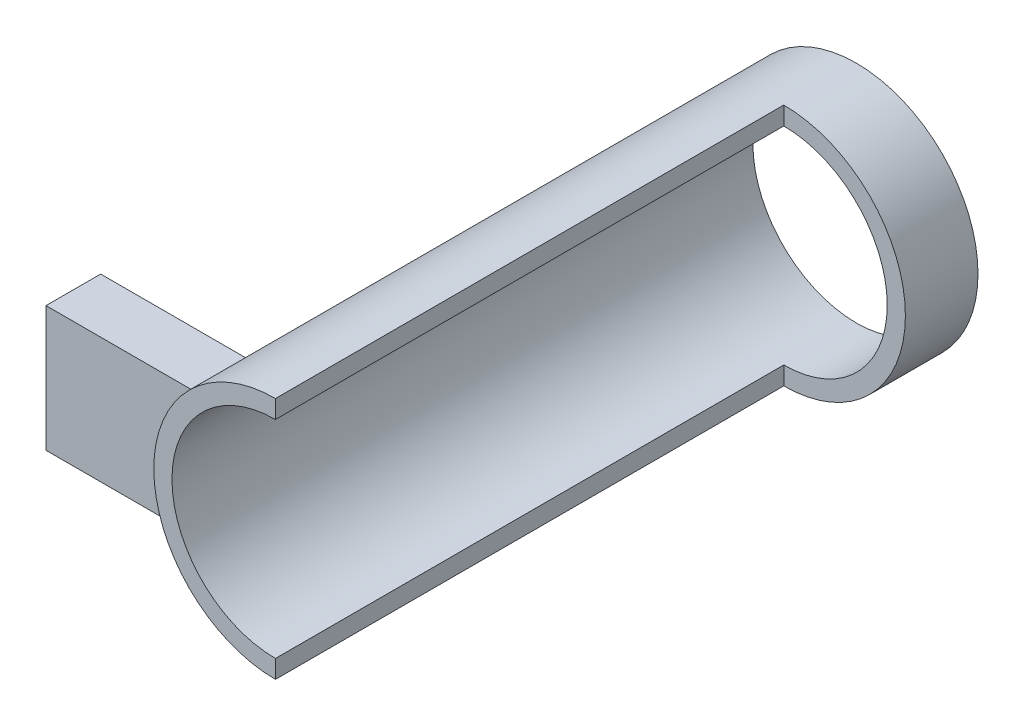
from build123d import *

# Parameters (mm, degrees)
ESQUISSE1_R             = 3.35
ESQUISSE1_R_2           = 2.85
BOSS_EXTRU_1_DEPTH      = 2
BOSS_EXTRU_2_DEPTH      = 14
ESQUISSE3_W             = 1.505412516
ESQUISSE3_H             = 3.452066632
BOSS_EXTRU_3_DEPTH      = 7
ENL_V_START             = -5
ESQUISSE4_R             = 2.85
ENL_V_MAT_EXTRU_1_DEPTH = 5


with BuildPart() as part:
    # Esquisse1 → Boss.-Extru.1 (new body)
    with BuildSketch(Plane.XY):
        Circle(ESQUISSE1_R)
        Circle(ESQUISSE1_R_2, mode=Mode.SUBTRACT)
    extrude(amount=BOSS_EXTRU_1_DEPTH)

    # Esquisse2 → Boss.-Extru.2 (add)
    with BuildSketch(Plane.XY.offset(2)):
        with BuildLine():
            Line((0, 3.35), (0, 2.85))
            ThreePointArc((0, 2.85), (-2.85, 0), (0, -2.85))
            Line((0, -2.85), (0, -3.35))
            ThreePointArc((0, -3.35), (-3.35, 0), (0, 3.35))
        make_face()
    extrude(amount=BOSS_EXTRU_2_DEPTH)

    # Esquisse3 → Boss.-Extru.3 (add)
    with BuildSketch(Plane(origin=(0, 0, 0), x_dir=(0, 0, -1), z_dir=(1, 0, 0))):
        with Locations((-14.566713218, 0)):
            Rectangle(ESQUISSE3_W, ESQUISSE3_H)
    extrude(amount=-BOSS_EXTRU_3_DEPTH)

    # Esquisse4 → Enlèv. mat.-Extru.1 (cut)
    with BuildSketch(Plane.XY.offset(16).offset(ENL_V_START)):
        with Locations(Location((0, 0, 0), (0, 0, 90))):
            Circle(ESQUISSE4_R)
    extrude(amount=ENL_V_MAT_EXTRU_1_DEPTH, mode=Mode.SUBTRACT)


solid = part.part
